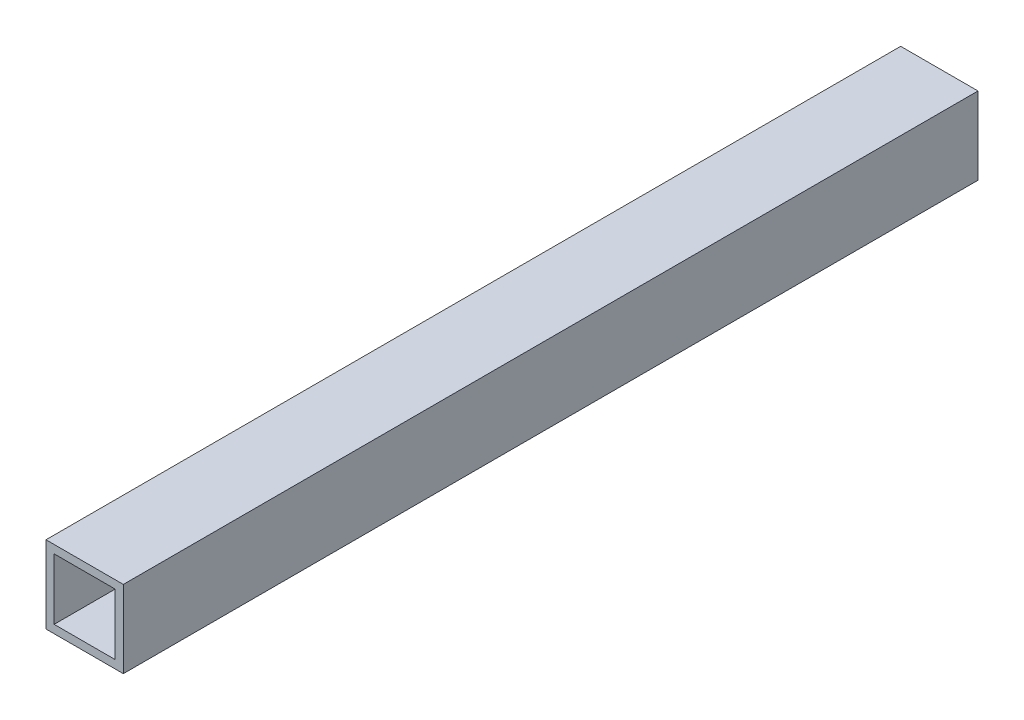
from build123d import *

# Parameters (mm, degrees)
SKETCH1_W           = 19
SKETCH1_H           = 19
SKETCH1_W_2         = 15
SKETCH1_H_2         = 15
BOSS_EXTRUDE1_DEPTH = 210


with BuildPart() as part:
    # Sketch1 → Boss-Extrude1 (new body)
    with BuildSketch(Plane.XY):
        Rectangle(SKETCH1_W, SKETCH1_H)
        Rectangle(SKETCH1_W_2, SKETCH1_H_2, mode=Mode.SUBTRACT)
    extrude(amount=BOSS_EXTRUDE1_DEPTH)


solid = part.part
